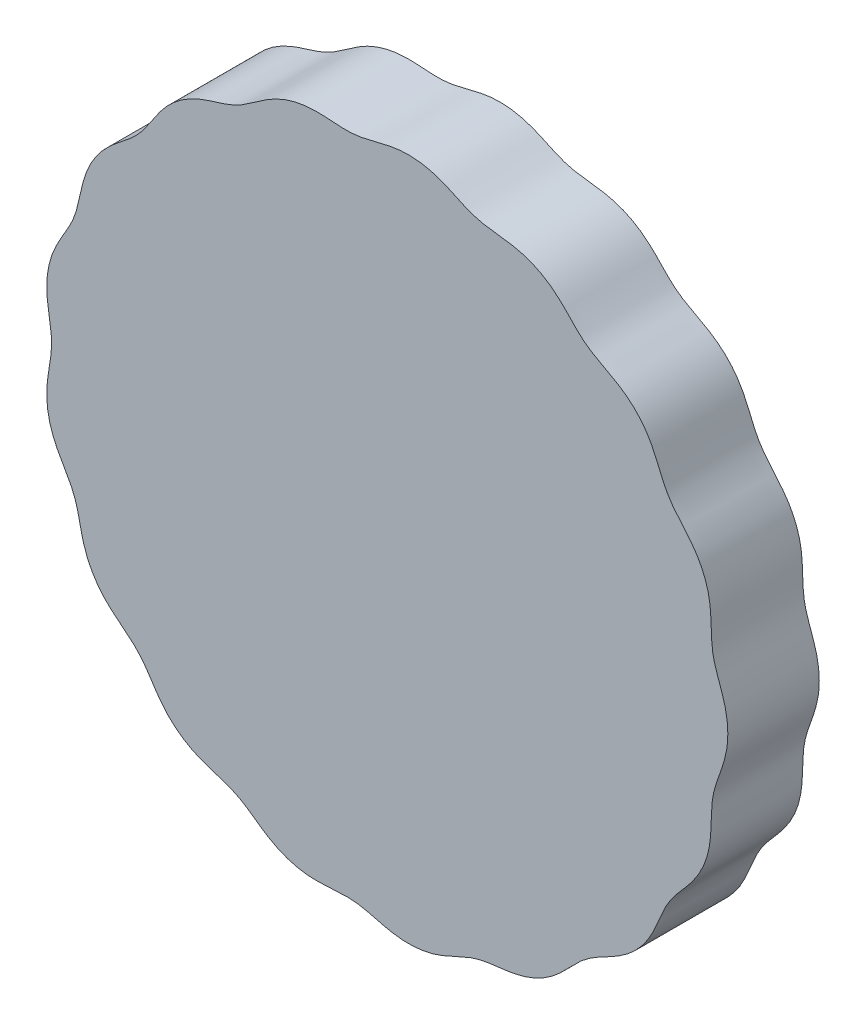
from build123d import *

# Parameters (mm, degrees)
BOSS_EXTRUDE1_DEPTH = 10


with BuildPart() as part:
    # Sketch2 → Boss-Extrude1 (new body)
    with BuildSketch(Plane.XY):
        with BuildLine():
            add(Edge.make_bspline(
                [(37.48, 0), (37.48, 0.075178242), (37.478322449, 0.22585947), (37.470705668, 0.452548867), (37.457778664, 0.680799205), (37.439240456, 0.911160311), (37.414772112, 1.143949805), (37.384089529, 1.379235209), (37.347008687, 1.616849603), (37.303476625, 1.856429261), (37.253598465, 2.097465255), (37.197642965, 2.339358747), (37.136020536, 2.581468839), (37.06927968, 2.823160752), (36.998076094, 3.063838358), (36.92314377, 3.302968371), (36.845282371, 3.540101233), (36.765323933, 3.774880375), (36.684111603, 4.007045523), (36.602490941, 4.236438618), (36.521282596, 4.462997257), (36.441274, 4.686753022), (36.363205353, 4.907824542), (36.28775931, 5.126409313), (36.215551358, 5.342775941), (36.147124421, 5.557253762), (36.082939498, 5.770222896), (36.023371399, 5.982103227), (35.968707527, 6.19334468), (35.919137395, 6.404414384), (35.874759384, 6.615787195), (35.835574051, 6.82793474), (35.801487369, 7.041314777), (35.772312327, 7.256362426), (35.747769521, 7.473478796), (35.727498797, 7.693022062), (35.711056157, 7.915298031), (35.697928433, 8.140551439), (35.687537583, 8.368957377), (35.679251369, 8.600612866), (35.672387324, 8.835529989), (35.66623616, 9.073630301), (35.66006021, 9.314739735), (35.653112028, 9.558585877), (35.644651555, 9.804796808), (35.633953524, 10.052902322), (35.620331131, 10.30233938), (35.603146701, 10.552460303), (35.581833793, 10.802546429), (35.555914545, 11.051827359), (35.525014044, 11.299508464), (35.488871798, 11.544804455), (35.447356629, 11.78698201), (35.400457685, 12.02540694), (35.348279119, 12.259597053), (35.291013733, 12.489270484), (35.228898686, 12.714382206), (35.162167805, 12.935142194), (35.090993895, 13.152004094), (35.01542917, 13.365617568), (34.935376671, 13.576754714), (34.850581775, 13.786214826), (34.760650329, 13.994724041), (34.665117474, 14.202857249), (34.563512478, 14.410981267), (34.455438306, 14.619235648), (34.340633842, 14.82754505), (34.219022112, 15.035659828), (34.090719386, 15.243203199), (33.956045778, 15.449732771), (33.815489892, 15.65478302), (33.669696693, 15.857915354), (33.519423033, 16.05874732), (33.365502857, 16.256970324), (33.208827585, 16.45237613), (33.050301587, 16.644847995), (32.890826318, 16.834370263), (32.731281668, 17.02102633), (32.572498367, 17.204983691), (32.415256579, 17.386497869), (32.260267267, 17.565895068), (32.108160873, 17.743561026), (31.959490238, 17.919937481), (31.814714523, 18.095501119), (31.674205492, 18.270760978), (31.538238747, 18.446239038), (31.406997708, 18.622464624), (31.280565039, 18.799953804), (31.15893923, 18.979210964), (31.042021361, 19.160706627), (30.929626045, 19.344872972), (30.821488519, 19.532096192), (30.717261188, 19.722700801), (30.616526948, 19.91694825), (30.518813274, 20.115030905), (30.423583002, 20.317057649), (30.330266006, 20.523057917), (30.238250813, 20.732967723), (30.146913256, 20.946633861), (30.055612243, 21.163804317), (29.963712362, 21.384131089), (29.870596225, 21.607170252), (29.775670238, 21.832380245), (29.678383537, 22.059130216), (29.57824677, 22.286708464), (29.474830679, 22.51432785), (29.367791555, 22.741145869), (29.256879822, 22.966283883), (29.141943818, 23.188850286), (29.022941092, 23.407975167), (28.899930846, 23.622845416), (28.773069162, 23.832749725), (28.642588668, 24.037123227), (28.508765381, 24.235589845), (28.371876034, 24.427996512), (28.23214737, 24.614431482), (28.089697834, 24.795213927), (27.944493701, 24.970857865), (27.796316611, 25.14200554), (27.644768057, 25.309343941), (27.489294013, 25.473507811), (27.329262793, 25.635011197), (27.164033854, 25.794183575), (26.993060069, 25.951165035), (26.81595148, 26.105910072), (26.632534111, 26.258235655), (26.442865382, 26.407867107), (26.247232129, 26.55449681), (26.046121262, 26.6978274), (25.840186716, 26.837617303), (25.630204925, 26.9737051), (25.417030711, 27.106024257), (25.201558612, 27.234608536), (24.984693579, 27.35960253), (24.767314825, 27.48123886), (24.550261514, 27.599848348), (24.334310167, 27.715834334), (24.12016192, 27.829667441), (23.908437645, 27.941876952), (23.699662064, 28.053024173), (23.494271806, 28.163709249), (23.292602625, 28.274539245), (23.094894993, 28.386127204), (22.901294179, 28.499077673), (22.711852922, 28.613974105), (22.526535054, 28.731367969), (22.345217613, 28.851764021), (22.167702942, 28.975621266), (21.99371614, 29.1033311), (21.822917519, 29.235216917), (21.65490991, 29.371527621), (21.489244435, 29.512427003), (21.32543501, 29.657996299), (21.162958206, 29.808218504), (21.001281895, 29.962995569), (20.839853542, 30.1221227), (20.678133867, 30.285308945), (20.515598553, 30.452168452), (20.351743292, 30.622214792), (20.186114769, 30.794884064), (20.018302446, 30.969519294), (19.847963546, 31.145392193), (19.674826235, 31.32170404), (19.498702947, 31.497603208), (19.319498683, 31.672198396), (19.137212054, 31.844575517), (18.951946773, 32.013828336), (18.763900024, 32.179078193), (18.573360197, 32.339511201), (18.380688849, 32.494412281), (18.186294272, 32.643200536), (17.990595376, 32.785464555), (17.793977611, 32.92099259), (17.596731366, 33.04977484), (17.399009086, 33.172011909), (17.200769228, 33.288070309), (17.001755566, 33.398431983), (16.801496227, 33.503618281), (16.599344717, 33.604113664), (16.394542446, 33.700286982), (16.1863175, 33.792358061), (15.973976109, 33.880376962), (15.756990189, 33.964249767), (15.535057808, 34.043785433), (15.308124571, 34.118740179), (15.076387482, 34.188888837), (14.840259851, 34.254058694), (14.600330729, 34.314165362), (14.357316574, 34.369245403), (14.112008153, 34.419443088), (13.865230834, 34.465029701), (13.617802274, 34.506377946), (13.370506519, 34.543964584), (13.124067272, 34.578337987), (12.879133733, 34.610117476), (12.636267598, 34.63997095), (12.395936191, 34.668594025), (12.158508735, 34.696701452), (11.924256566, 34.725015494), (11.693350585, 34.754240848), (11.465869266, 34.78506532), (11.241799243, 34.818141976), (11.02104344, 34.854073791), (10.803427432, 34.893416859), (10.588706187, 34.936657528), (10.376573289, 34.984215145), (10.166668061, 35.036422943), (9.958586963, 35.09353811), (9.75189071, 35.155720754), (9.546115339, 35.223044448), (9.340780586, 35.29547953), (9.135404579, 35.372912728), (8.929507087, 35.455121316), (8.72263052, 35.541804111), (8.514340976, 35.632557325), (8.304248285, 35.72689934), (8.092010401, 35.824262608), (7.877348413, 35.924008598), (7.660051257, 36.025424387), (7.439992914, 36.127749804), (7.217129978, 36.230168104), (6.991515531, 36.331834803), (6.763299933, 36.431884862), (6.532733192, 36.529452855), (6.300162253, 36.623693722), (6.066025367, 36.713807776), (5.830836002, 36.799060172), (5.595166236, 36.878818042), (5.359612703, 36.952566516), (5.124761113, 37.019939772), (4.891136457, 37.080736126), (4.659149338, 37.134923285), (4.429041421, 37.182627326), (4.200841768, 37.224109405), (3.974336027, 37.259705685), (3.749069812, 37.289770467), (3.52438319, 37.314607451), (3.299479947, 37.334411252), (3.073519557, 37.349222128), (2.8457201, 37.35894429), (2.615448418, 37.36335784), (2.382287491, 37.362172382), (2.146069359, 37.355108801), (1.906874291, 37.341935091), (1.665002975, 37.322530937), (1.420930863, 37.296908991), (1.175253657, 37.26523878), (0.928636876, 37.227825344), (0.681764221, 37.185123923), (0.435302402, 37.137697715), (0.189868895, 37.086206907), (-0.053991616, 37.031390213), (-0.295818193, 36.974028671), (-0.535247081, 36.914937016), (-0.772011608, 36.854939334), (-1.005946804, 36.794854766), (-1.236982681, 36.735479165), (-1.465142879, 36.677570647), (-1.690537113, 36.621844226), (-1.913354776, 36.568958203), (-2.133854298, 36.519501165), (-2.35235627, 36.473992976), (-2.56923111, 36.432868846), (-2.784890031, 36.396481873), (-2.999773794, 36.365091817), (-3.214342925, 36.338867424), (-3.429066444, 36.317884077), (-3.644411469, 36.302116009), (-3.860833427, 36.291443009), (-4.078765878, 36.285655968), (-4.298609982, 36.284451338), (-4.520725674, 36.287438796), (-4.745420723, 36.29415558), (-4.972942624, 36.304058185), (-5.203468233, 36.316545404), (-5.437097392, 36.330953239), (-5.673843427, 36.346579415), (-5.913629039, 36.362680187), (-6.156280498, 36.378494768), (-6.401525317, 36.393246009), (-6.648991244, 36.406166907), (-6.898208788, 36.416512868), (-7.148616915, 36.423573629), (-7.399573535, 36.426696749), (-7.650370765, 36.425311508), (-7.900259331, 36.418938595), (-8.14847732, 36.407208915), (-8.394290178, 36.389889067), (-8.637036148, 36.366865326), (-8.87617912, 36.338166158), (-9.111359177, 36.30392677), (-9.342438496, 36.26436516), (-9.569528805, 36.219733445), (-9.792995498, 36.170262351), (-10.013425677, 36.116099578), (-10.23156669, 36.057263992), (-10.44823604, 35.993618895), (-10.664220991, 35.92488019), (-10.880186452, 35.850654311), (-11.09660681, 35.770508426), (-11.313726684, 35.684036058), (-11.531558528, 35.59092948), (-11.749913042, 35.491037352), (-11.968441586, 35.384387607), (-12.186691982, 35.271198101), (-12.404163053, 35.151868852), (-12.620350054, 35.026956448), (-12.834784946, 34.897147037), (-13.047065135, 34.763225956), (-13.256868844, 34.626039905), (-13.463970493, 34.48647708), (-13.668242009, 34.3454352), (-13.869653604, 34.203800464), (-14.068273293, 34.06243373), (-14.264255916, 33.922147283), (-14.457837587, 33.783696641), (-14.649327636, 33.647769678), (-14.839096854, 33.514979821), (-15.027566269, 33.385854465), (-15.215197218, 33.260836718), (-15.402480239, 33.140278413), (-15.589918547, 33.024433104), (-15.778024426, 32.913466411), (-15.967300877, 32.807444468), (-16.158234543, 32.706343398), (-16.351282159, 32.610042688), (-16.546865361, 32.518340403), (-16.745355458, 32.430943733), (-16.947070201, 32.347487037), (-17.152261507, 32.267527085), (-17.361114088, 32.190568228), (-17.573729982, 32.116048899), (-17.790131053, 32.043373645), (-18.010247125, 31.971908306), (-18.233915289, 31.900996209), (-18.460877342, 31.82997818), (-18.690774738, 31.758187301), (-18.923153424, 31.684980711), (-19.157463116, 31.609742134), (-19.393064135, 31.531897812), (-19.629234216, 31.450930366), (-19.865184941, 31.36639858), (-20.100073037, 31.27794059), (-20.333030388, 31.18529869), (-20.563184694, 31.088310467), (-20.789705564, 30.986934693), (-21.011837084, 30.881229518), (-21.228950064, 30.771350299), (-21.440585647, 30.657522195), (-21.646498768, 30.54000654), (-21.846681397, 30.419049055), (-22.041373008, 30.294830044), (-22.231030795, 30.167404642), (-22.416283881, 30.036672561), (-22.597840854, 29.902345045), (-22.776407899, 29.76397582), (-22.952594104, 29.620998681), (-23.126845453, 29.472806626), (-23.299410392, 29.318836162), (-23.470337101, 29.158648648), (-23.639499062, 28.991988686), (-23.806645906, 28.818822544), (-23.971453074, 28.639341527), (-24.133580148, 28.453949191), (-24.292708494, 28.263226552), (-24.448584548, 28.067898619), (-24.601034032, 27.868788308), (-24.749982131, 27.666779978), (-24.895453359, 27.462783191), (-25.037576187, 27.257704858), (-25.176571959, 27.052421957), (-25.312747073, 26.847761178), (-25.446486917, 26.644487277), (-25.57824333, 26.443289952), (-25.708514362, 26.244770732), (-25.83784821, 26.049446626), (-25.966808745, 25.857733918), (-26.095988574, 25.669960486), (-26.22597238, 25.486352211), (-26.357342319, 25.307043398), (-26.490659454, 25.132076431), (-26.626449734, 24.961400879), (-26.765201524, 24.794885345), (-26.90734689, 24.632314536), (-27.053260735, 24.473402717), (-27.203247102, 24.317794255), (-27.357534231, 24.165073698), (-27.516271375, 24.014775924), (-27.679520016, 23.866392995), (-27.847252886, 23.719386211), (-28.019348929, 23.573196137), (-28.195596806, 23.427259198), (-28.375682416, 23.281007642), (-28.559203473, 23.133896382), (-28.745662591, 22.985405891), (-28.934469792, 22.835053417), (-29.124955637, 22.682414191), (-29.31637003, 22.527122869), (-29.507897914, 22.368888296), (-29.698674766, 22.207509146), (-29.887796174, 22.042870199), (-30.07434982, 21.874961722), (-30.257432782, 21.703869888), (-30.436186912, 21.529778425), (-30.609837742, 21.352961616), (-30.777725399, 21.173756115), (-30.93935143, 20.992539683), (-31.094402718, 20.809682202), (-31.242785499, 20.625504069), (-31.384616051, 20.440211464), (-31.520219057, 20.253857769), (-31.650062559, 20.066291666), (-31.774701201, 19.877152442), (-31.894691311, 19.685888147), (-32.010508884, 19.491805763), (-32.122487149, 19.294153412), (-32.230795615, 19.092218351), (-32.335433207, 18.885413882), (-32.436264207, 18.673351582), (-32.533070191, 18.455884013), (-32.625603894, 18.233113853), (-32.71363789, 18.005374122), (-32.797015737, 17.773196464), (-32.875667725, 17.537260117), (-32.949640003, 17.298347978), (-33.019084885, 17.057295855), (-33.084274413, 16.814956795), (-33.145575877, 16.572164421), (-33.20345086, 16.329708206), (-33.258434392, 16.088312996), (-33.311122116, 15.848624499), (-33.362157668, 15.611201133), (-33.412211979, 15.376504917), (-33.461971326, 15.144899466), (-33.512131545, 14.916651763), (-33.563369172, 14.691929019), (-33.616347381, 14.470807219), (-33.67168638, 14.253269508), (-33.729972892, 14.039218031), (-33.791728971, 13.828473794), (-33.857419322, 13.620789454), (-33.927438297, 13.415855713), (-34.00209503, 13.213306362), (-34.081622909, 13.012732609), (-34.166157731, 12.813686066), (-34.255749784, 12.615694415), (-34.350349384, 12.418266547), (-34.449815946, 12.220907192), (-34.553913678, 12.0231265), (-34.662310696, 11.824449482), (-34.774586211, 11.624430744), (-34.890235297, 11.422666009), (-35.008664619, 11.218798594), (-35.129214055, 11.012537324), (-35.251147184, 10.803658888), (-35.373673516, 10.592021542), (-35.495959898, 10.377574346), (-35.617134073, 10.160355972), (-35.736314316, 9.940507594), (-35.852621984, 9.718268319), (-35.965204596, 9.493972646), (-36.073265738, 9.268042443), (-36.176089048, 9.040970872), (-36.2730708, 8.813298171), (-36.363745836, 8.58557718), (-36.44781335, 8.358330429), (-36.525151031, 8.131998184), (-36.595812963, 7.906884094), (-36.660013296, 7.683103115), (-36.718086542, 7.460545144), (-36.770420525, 7.238857504), (-36.817397438, 7.017468789), (-36.859316247, 6.795637718), (-36.896343689, 6.572538941), (-36.928495128, 6.347360302), (-36.9556456, 6.119402507), (-36.977568583, 5.888156386), (-36.993997324, 5.653353931), (-37.004676875, 5.414980629), (-37.009434121, 5.173261626), (-37.008197779, 4.928621662), (-37.001038672, 4.681635897), (-36.988163487, 4.432975584), (-36.969916966, 4.183359196), (-36.946769912, 3.933508249), (-36.919294813, 3.684113395), (-36.888154821, 3.435806157), (-36.854072144, 3.189141922), (-36.817812925, 2.944587035), (-36.780173235, 2.702511003), (-36.741949827, 2.463184501), (-36.703934085, 2.226778683), (-36.666897124, 1.993367108), (-36.631568498, 1.762933137), (-36.598639187, 1.535372464), (-36.568737342, 1.310503499), (-36.542430196, 1.088073938), (-36.520207513, 0.867771442), (-36.502484036, 0.649232056), (-36.489587134, 0.432050865), (-36.481751935, 0.215792247), (-36.479125251, 0), (-36.481751935, -0.215792247), (-36.489587134, -0.432050865), (-36.502484036, -0.649232056), (-36.520207513, -0.867771442), (-36.542430196, -1.088073938), (-36.568737342, -1.310503499), (-36.598639187, -1.535372464), (-36.631568498, -1.762933137), (-36.666897124, -1.993367108), (-36.703934085, -2.226778683), (-36.741949827, -2.463184501), (-36.780173235, -2.702511003), (-36.817812925, -2.944587035), (-36.854072144, -3.189141922), (-36.888154821, -3.435806157), (-36.919294813, -3.684113395), (-36.946769912, -3.933508249), (-36.969916966, -4.183359196), (-36.988163487, -4.432975584), (-37.001038672, -4.681635897), (-37.008197779, -4.928621662), (-37.009434121, -5.173261626), (-37.004676875, -5.414980629), (-36.993997324, -5.653353931), (-36.977568583, -5.888156386), (-36.9556456, -6.119402507), (-36.928495128, -6.347360302), (-36.896343689, -6.572538941), (-36.859316247, -6.795637718), (-36.817397438, -7.017468789), (-36.770420525, -7.238857504), (-36.718086542, -7.460545144), (-36.660013296, -7.683103115), (-36.595812963, -7.906884094), (-36.525151031, -8.131998184), (-36.44781335, -8.358330429), (-36.363745836, -8.58557718), (-36.2730708, -8.813298171), (-36.176089048, -9.040970872), (-36.073265738, -9.268042443), (-35.965204596, -9.493972646), (-35.852621984, -9.718268319), (-35.736314316, -9.940507594), (-35.617134073, -10.160355972), (-35.495959898, -10.377574346), (-35.373673516, -10.592021542), (-35.251147184, -10.803658888), (-35.129214055, -11.012537324), (-35.008664619, -11.218798594), (-34.890235297, -11.422666009), (-34.774586211, -11.624430744), (-34.662310696, -11.824449482), (-34.553913678, -12.0231265), (-34.449815946, -12.220907192), (-34.350349384, -12.418266547), (-34.255749784, -12.615694415), (-34.166157731, -12.813686066), (-34.081622909, -13.012732609), (-34.00209503, -13.213306362), (-33.927438297, -13.415855713), (-33.857419322, -13.620789454), (-33.791728971, -13.828473794), (-33.729972892, -14.039218031), (-33.67168638, -14.253269508), (-33.616347381, -14.470807219), (-33.563369172, -14.691929019), (-33.512131545, -14.916651763), (-33.461971326, -15.144899466), (-33.412211979, -15.376504917), (-33.362157668, -15.611201133), (-33.311122116, -15.848624499), (-33.258434392, -16.088312996), (-33.20345086, -16.329708206), (-33.145575877, -16.572164421), (-33.084274413, -16.814956795), (-33.019084885, -17.057295855), (-32.949640003, -17.298347978), (-32.875667725, -17.537260117), (-32.797015737, -17.773196464), (-32.71363789, -18.005374122), (-32.625603894, -18.233113853), (-32.533070191, -18.455884013), (-32.436264207, -18.673351582), (-32.335433207, -18.885413882), (-32.230795615, -19.092218351), (-32.122487149, -19.294153412), (-32.010508884, -19.491805763), (-31.894691311, -19.685888147), (-31.774701201, -19.877152442), (-31.650062559, -20.066291666), (-31.520219057, -20.253857769), (-31.384616051, -20.440211464), (-31.242785499, -20.625504069), (-31.094402718, -20.809682202), (-30.93935143, -20.992539683), (-30.777725399, -21.173756115), (-30.609837742, -21.352961616), (-30.436186912, -21.529778425), (-30.257432782, -21.703869888), (-30.07434982, -21.874961722), (-29.887796174, -22.042870199), (-29.698674766, -22.207509146), (-29.507897914, -22.368888296), (-29.31637003, -22.527122869), (-29.124955637, -22.682414191), (-28.934469792, -22.835053417), (-28.745662591, -22.985405891), (-28.559203473, -23.133896382), (-28.375682416, -23.281007642), (-28.195596806, -23.427259198), (-28.019348929, -23.573196137), (-27.847252886, -23.719386211), (-27.679520016, -23.866392995), (-27.516271375, -24.014775924), (-27.357534231, -24.165073698), (-27.203247102, -24.317794255), (-27.053260735, -24.473402717), (-26.90734689, -24.632314536), (-26.765201524, -24.794885345), (-26.626449734, -24.961400879), (-26.490659454, -25.132076431), (-26.357342319, -25.307043398), (-26.22597238, -25.486352211), (-26.095988574, -25.669960486), (-25.966808745, -25.857733918), (-25.83784821, -26.049446626), (-25.708514362, -26.244770732), (-25.57824333, -26.443289952), (-25.446486917, -26.644487277), (-25.312747073, -26.847761178), (-25.176571959, -27.052421957), (-25.037576187, -27.257704858), (-24.895453359, -27.462783191), (-24.749982131, -27.666779978), (-24.601034032, -27.868788308), (-24.448584548, -28.067898619), (-24.292708494, -28.263226552), (-24.133580148, -28.453949191), (-23.971453074, -28.639341527), (-23.806645906, -28.818822544), (-23.639499062, -28.991988686), (-23.470337101, -29.158648648), (-23.299410392, -29.318836162), (-23.126845453, -29.472806626), (-22.952594104, -29.620998681), (-22.776407899, -29.76397582), (-22.597840854, -29.902345045), (-22.416283881, -30.036672561), (-22.231030795, -30.167404642), (-22.041373008, -30.294830044), (-21.846681397, -30.419049055), (-21.646498768, -30.54000654), (-21.440585647, -30.657522195), (-21.228950064, -30.771350299), (-21.011837084, -30.881229518), (-20.789705564, -30.986934693), (-20.563184694, -31.088310467), (-20.333030388, -31.18529869), (-20.100073037, -31.27794059), (-19.865184941, -31.36639858), (-19.629234216, -31.450930366), (-19.393064135, -31.531897812), (-19.157463116, -31.609742134), (-18.923153424, -31.684980711), (-18.690774738, -31.758187301), (-18.460877342, -31.82997818), (-18.233915289, -31.900996209), (-18.010247125, -31.971908306), (-17.790131053, -32.043373645), (-17.573729982, -32.116048899), (-17.361114088, -32.190568228), (-17.152261507, -32.267527085), (-16.947070201, -32.347487037), (-16.745355458, -32.430943733), (-16.546865361, -32.518340403), (-16.351282159, -32.610042688), (-16.158234543, -32.706343398), (-15.967300877, -32.807444468), (-15.778024426, -32.913466411), (-15.589918547, -33.024433104), (-15.402480239, -33.140278413), (-15.215197218, -33.260836718), (-15.027566269, -33.385854465), (-14.839096854, -33.514979821), (-14.649327636, -33.647769678), (-14.457837587, -33.783696641), (-14.264255916, -33.922147283), (-14.068273293, -34.06243373), (-13.869653604, -34.203800464), (-13.668242009, -34.3454352), (-13.463970493, -34.48647708), (-13.256868844, -34.626039905), (-13.047065135, -34.763225956), (-12.834784946, -34.897147037), (-12.620350054, -35.026956448), (-12.404163053, -35.151868852), (-12.186691982, -35.271198101), (-11.968441586, -35.384387607), (-11.749913042, -35.491037352), (-11.531558528, -35.59092948), (-11.313726684, -35.684036058), (-11.09660681, -35.770508426), (-10.880186452, -35.850654311), (-10.664220991, -35.92488019), (-10.44823604, -35.993618895), (-10.23156669, -36.057263992), (-10.013425677, -36.116099578), (-9.792995498, -36.170262351), (-9.569528805, -36.219733445), (-9.342438496, -36.26436516), (-9.111359177, -36.30392677), (-8.87617912, -36.338166158), (-8.637036148, -36.366865326), (-8.394290178, -36.389889067), (-8.14847732, -36.407208915), (-7.900259331, -36.418938595), (-7.650370765, -36.425311508), (-7.399573535, -36.426696749), (-7.148616915, -36.423573629), (-6.898208788, -36.416512868), (-6.648991244, -36.406166907), (-6.401525317, -36.393246009), (-6.156280498, -36.378494768), (-5.913629039, -36.362680187), (-5.673843427, -36.346579415), (-5.437097392, -36.330953239), (-5.203468233, -36.316545404), (-4.972942624, -36.304058185), (-4.745420723, -36.29415558), (-4.520725674, -36.287438796), (-4.298609982, -36.284451338), (-4.078765878, -36.285655968), (-3.860833427, -36.291443009), (-3.644411469, -36.302116009), (-3.429066444, -36.317884077), (-3.214342925, -36.338867424), (-2.999773794, -36.365091817), (-2.784890031, -36.396481873), (-2.56923111, -36.432868846), (-2.35235627, -36.473992976), (-2.133854298, -36.519501165), (-1.913354776, -36.568958203), (-1.690537113, -36.621844226), (-1.465142879, -36.677570647), (-1.236982681, -36.735479165), (-1.005946804, -36.794854766), (-0.772011608, -36.854939334), (-0.535247081, -36.914937016), (-0.295818193, -36.974028671), (-0.053991616, -37.031390213), (0.189868895, -37.086206907), (0.435302402, -37.137697715), (0.681764221, -37.185123923), (0.928636876, -37.227825344), (1.175253657, -37.26523878), (1.420930863, -37.296908991), (1.665002975, -37.322530937), (1.906874291, -37.341935091), (2.146069359, -37.355108801), (2.382287491, -37.362172382), (2.615448418, -37.36335784), (2.8457201, -37.35894429), (3.073519557, -37.349222128), (3.299479947, -37.334411252), (3.52438319, -37.314607451), (3.749069812, -37.289770467), (3.974336027, -37.259705685), (4.200841768, -37.224109405), (4.429041421, -37.182627326), (4.659149338, -37.134923285), (4.891136457, -37.080736126), (5.124761113, -37.019939772), (5.359612703, -36.952566516), (5.595166236, -36.878818042), (5.830836002, -36.799060172), (6.066025367, -36.713807776), (6.300162253, -36.623693722), (6.532733192, -36.529452855), (6.763299933, -36.431884862), (6.991515531, -36.331834803), (7.217129978, -36.230168104), (7.439992914, -36.127749804), (7.660051257, -36.025424387), (7.877348413, -35.924008598), (8.092010401, -35.824262608), (8.304248285, -35.72689934), (8.514340976, -35.632557325), (8.72263052, -35.541804111), (8.929507087, -35.455121316), (9.135404579, -35.372912728), (9.340780586, -35.29547953), (9.546115339, -35.223044448), (9.75189071, -35.155720754), (9.958586963, -35.09353811), (10.166668061, -35.036422943), (10.376573289, -34.984215145), (10.588706187, -34.936657528), (10.803427432, -34.893416859), (11.02104344, -34.854073791), (11.241799243, -34.818141976), (11.465869266, -34.78506532), (11.693350585, -34.754240848), (11.924256566, -34.725015494), (12.158508735, -34.696701452), (12.395936191, -34.668594025), (12.636267598, -34.63997095), (12.879133733, -34.610117476), (13.124067272, -34.578337987), (13.370506519, -34.543964584), (13.617802274, -34.506377946), (13.865230834, -34.465029701), (14.112008153, -34.419443088), (14.357316574, -34.369245403), (14.600330729, -34.314165362), (14.840259851, -34.254058694), (15.076387482, -34.188888837), (15.308124571, -34.118740179), (15.535057808, -34.043785433), (15.756990189, -33.964249767), (15.973976109, -33.880376962), (16.1863175, -33.792358061), (16.394542446, -33.700286982), (16.599344717, -33.604113664), (16.801496227, -33.503618281), (17.001755566, -33.398431983), (17.200769228, -33.288070309), (17.399009086, -33.172011909), (17.596731366, -33.04977484), (17.793977611, -32.92099259), (17.990595376, -32.785464555), (18.186294272, -32.643200536), (18.380688849, -32.494412281), (18.573360197, -32.339511201), (18.763900024, -32.179078193), (18.951946773, -32.013828336), (19.137212054, -31.844575517), (19.319498683, -31.672198396), (19.498702947, -31.497603208), (19.674826235, -31.32170404), (19.847963546, -31.145392193), (20.018302446, -30.969519294), (20.186114769, -30.794884064), (20.351743292, -30.622214792), (20.515598553, -30.452168452), (20.678133867, -30.285308945), (20.839853542, -30.1221227), (21.001281895, -29.962995569), (21.162958206, -29.808218504), (21.32543501, -29.657996299), (21.489244435, -29.512427003), (21.65490991, -29.371527621), (21.822917519, -29.235216917), (21.99371614, -29.1033311), (22.167702942, -28.975621266), (22.345217613, -28.851764021), (22.526535054, -28.731367969), (22.711852922, -28.613974105), (22.901294179, -28.499077673), (23.094894993, -28.386127204), (23.292602625, -28.274539245), (23.494271806, -28.163709249), (23.699662064, -28.053024173), (23.908437645, -27.941876952), (24.12016192, -27.829667441), (24.334310167, -27.715834334), (24.550261514, -27.599848348), (24.767314825, -27.48123886), (24.984693579, -27.35960253), (25.201558612, -27.234608536), (25.417030711, -27.106024257), (25.630204925, -26.9737051), (25.840186716, -26.837617303), (26.046121262, -26.6978274), (26.247232129, -26.55449681), (26.442865382, -26.407867107), (26.632534111, -26.258235655), (26.81595148, -26.105910072), (26.993060069, -25.951165035), (27.164033854, -25.794183575), (27.329262793, -25.635011197), (27.489294013, -25.473507811), (27.644768057, -25.309343941), (27.796316611, -25.14200554), (27.944493701, -24.970857865), (28.089697834, -24.795213927), (28.23214737, -24.614431482), (28.371876034, -24.427996512), (28.508765381, -24.235589845), (28.642588668, -24.037123227), (28.773069162, -23.832749725), (28.899930846, -23.622845416), (29.022941092, -23.407975167), (29.141943818, -23.188850286), (29.256879822, -22.966283883), (29.367791555, -22.741145869), (29.474830679, -22.51432785), (29.57824677, -22.286708464), (29.678383537, -22.059130216), (29.775670238, -21.832380245), (29.870596225, -21.607170252), (29.963712362, -21.384131089), (30.055612243, -21.163804317), (30.146913256, -20.946633861), (30.238250813, -20.732967723), (30.330266006, -20.523057917), (30.423583002, -20.317057649), (30.518813274, -20.115030905), (30.616526948, -19.91694825), (30.717261188, -19.722700801), (30.821488519, -19.532096192), (30.929626045, -19.344872972), (31.042021361, -19.160706627), (31.15893923, -18.979210964), (31.280565039, -18.799953804), (31.406997708, -18.622464624), (31.538238747, -18.446239038), (31.674205492, -18.270760978), (31.814714523, -18.095501119), (31.959490238, -17.919937481), (32.108160873, -17.743561026), (32.260267267, -17.565895068), (32.415256579, -17.386497869), (32.572498367, -17.204983691), (32.731281668, -17.02102633), (32.890826318, -16.834370263), (33.050301587, -16.644847995), (33.208827585, -16.45237613), (33.365502857, -16.256970324), (33.519423033, -16.05874732), (33.669696693, -15.857915354), (33.815489892, -15.65478302), (33.956045778, -15.449732771), (34.090719386, -15.243203199), (34.219022112, -15.035659828), (34.340633842, -14.82754505), (34.455438306, -14.619235648), (34.563512478, -14.410981267), (34.665117474, -14.202857249), (34.760650329, -13.994724041), (34.850581775, -13.786214826), (34.935376671, -13.576754714), (35.01542917, -13.365617568), (35.090993895, -13.152004094), (35.162167805, -12.935142194), (35.228898686, -12.714382206), (35.291013733, -12.489270484), (35.348279119, -12.259597053), (35.400457685, -12.02540694), (35.447356629, -11.78698201), (35.488871798, -11.544804455), (35.525014044, -11.299508464), (35.555914545, -11.051827359), (35.581833793, -10.802546429), (35.603146701, -10.552460303), (35.620331131, -10.30233938), (35.633953524, -10.052902322), (35.644651555, -9.804796808), (35.653112028, -9.558585877), (35.66006021, -9.314739735), (35.66623616, -9.073630301), (35.672387324, -8.835529989), (35.679251369, -8.600612866), (35.687537583, -8.368957377), (35.697928433, -8.140551439), (35.711056157, -7.915298031), (35.727498797, -7.693022062), (35.747769521, -7.473478796), (35.772312327, -7.256362426), (35.801487369, -7.041314777), (35.835574051, -6.82793474), (35.874759384, -6.615787195), (35.919137395, -6.404414384), (35.968707527, -6.19334468), (36.023371399, -5.982103227), (36.082939498, -5.770222896), (36.147124421, -5.557253762), (36.215551358, -5.342775941), (36.28775931, -5.126409313), (36.363205353, -4.907824542), (36.441274, -4.686753022), (36.521282596, -4.462997257), (36.602490941, -4.236438618), (36.684111603, -4.007045523), (36.765323933, -3.774880375), (36.845282371, -3.540101233), (36.92314377, -3.302968371), (36.998076094, -3.063838358), (37.06927968, -2.823160752), (37.136020536, -2.581468839), (37.197642965, -2.339358747), (37.253598465, -2.097465255), (37.303476625, -1.856429261), (37.347008687, -1.616849603), (37.384089529, -1.379235209), (37.414772112, -1.143949805), (37.439240456, -0.911160311), (37.457778664, -0.680799205), (37.470705668, -0.452548867), (37.478322449, -0.22585947), (37.48, -0.075178242), (37.48, 0)],
                knots=[0, 0, 0, 0, 0.000957102, 0.001918338, 0.002887447, 0.003867432, 0.004860345, 0.005867197, 0.006887982, 0.007921793, 0.008967001, 0.010021416, 0.01108248, 0.012147431, 0.01321345, 0.01427776, 0.015337734, 0.016390971, 0.017435362, 0.018469111, 0.019490813, 0.020499461, 0.021494463, 0.022475681, 0.023443411, 0.02439839, 0.025341775, 0.026275118, 0.027200311, 0.028119535, 0.029035187, 0.02994978, 0.030865878, 0.031785986, 0.032712467, 0.033647456, 0.034592784, 0.03554994, 0.036520009, 0.03750365, 0.038501085, 0.03951209, 0.040536002, 0.041571743, 0.042617834, 0.043672426, 0.044733346, 0.045798154, 0.04686419, 0.047928661, 0.048988746, 0.050041711, 0.051085055, 0.05211667, 0.053135036, 0.054139402, 0.055129931, 0.056107817, 0.057075294, 0.058035513, 0.058992307, 0.059949846, 0.060912216, 0.061883052, 0.062865199, 0.063860529, 0.064869869, 0.065893041, 0.066928999, 0.067976005, 0.069031783, 0.070093741, 0.071159085, 0.072225, 0.073288728, 0.074347682, 0.075399504, 0.076442134, 0.077473853, 0.078493311, 0.079499581, 0.080492151, 0.081470951, 0.082436366, 0.083389201, 0.084330692, 0.085262449, 0.086186427, 0.087104842, 0.088020116, 0.088934791, 0.089851418, 0.090772488, 0.091700321, 0.092637008, 0.093584328, 0.094543696, 0.095516126, 0.096502198, 0.097502054, 0.098515397, 0.099541489, 0.100579176, 0.101626908, 0.102682785, 0.103744577, 0.104809796, 0.10587576, 0.106939662, 0.107998686, 0.109050127, 0.110091538, 0.111120907, 0.112136834, 0.113138715, 0.114126895, 0.115102756, 0.116068703, 0.117028021, 0.117984641, 0.118942742, 0.119906363, 0.120879013, 0.121863381, 0.122861153, 0.123872969, 0.124898497, 0.125936551, 0.12698528, 0.128042346, 0.129105105, 0.130170755, 0.131236482, 0.132299549, 0.13335741, 0.134407748, 0.13544857, 0.136478207, 0.137495395, 0.138499271, 0.139489403, 0.140465804, 0.141428926, 0.142379658, 0.143319305, 0.144249539, 0.145172365, 0.146090047, 0.14700503, 0.147919865, 0.148837098, 0.149759198, 0.150688452, 0.151626896, 0.152576249, 0.153537857, 0.154512667, 0.155501173, 0.156503444, 0.157519104, 0.158547336, 0.159586915, 0.160636236, 0.161693323, 0.16275591, 0.163821463, 0.164887269, 0.165950512, 0.167008389, 0.168058227, 0.169097645, 0.170124723, 0.17113819, 0.172137599, 0.173123477, 0.174097384, 0.1750619, 0.176020444, 0.17697702, 0.177935811, 0.178900792, 0.179875344, 0.180861983, 0.181862217, 0.182876501, 0.183904349, 0.184944437, 0.185994816, 0.187053085, 0.18811656, 0.189182429, 0.190247878, 0.19131021, 0.192366903, 0.193415695, 0.194454652, 0.195482178, 0.196497064, 0.197498536, 0.198486227, 0.19946024, 0.200421099, 0.201369773, 0.202307625, 0.203236398, 0.204158144, 0.205075169, 0.205989937, 0.206905014, 0.207822929, 0.208746133, 0.209676868, 0.210617122, 0.211568554, 0.212532436, 0.213509635, 0.214500578, 0.215505252, 0.216523202, 0.217553537, 0.218594963, 0.219645806, 0.22070404, 0.221767338, 0.222833135, 0.223898697, 0.224961193, 0.226017839, 0.227066002, 0.228103366, 0.229128111, 0.230139104, 0.231136059, 0.232119682, 0.233091718, 0.234054909, 0.235012806, 0.235969469, 0.236929076, 0.23789552, 0.238872049, 0.239861009, 0.240863716, 0.241880458, 0.242910581, 0.243952643, 0.2450046, 0.24606399, 0.247128089, 0.248194088, 0.249259182, 0.25032069, 0.251376147, 0.252423335, 0.253460381, 0.254485748, 0.255498317, 0.256497365, 0.257482628, 0.258454268, 0.259412892, 0.260359544, 0.261295659, 0.262223034, 0.263143774, 0.264060217, 0.264974857, 0.265890248, 0.266808926, 0.267733301, 0.26866558, 0.269607696, 0.270561245, 0.271527424, 0.272507031, 0.273500413, 0.274507477, 0.275527687, 0.276560086, 0.277603309, 0.278655609, 0.279714912, 0.280778845, 0.281844801, 0.282910027, 0.283971693, 0.285027026, 0.286073441, 0.28710869, 0.28813107, 0.289139582, 0.2901341, 0.291115523, 0.292085774, 0.293047752, 0.294005127, 0.29496201, 0.295922557, 0.296890565, 0.297869146, 0.298860467, 0.29986566, 0.300884834, 0.301917187, 0.302961157, 0.304014614, 0.30507504, 0.306139679, 0.307205717, 0.308270368, 0.309330984, 0.310385133, 0.311430662, 0.312465745, 0.313488924, 0.314499144, 0.315495767, 0.316478603, 0.317447886, 0.318404314, 0.319348991, 0.320283421, 0.321209467, 0.322129272, 0.323045213, 0.323959798, 0.32487559, 0.325795102, 0.326720717, 0.327654599, 0.328598629, 0.329554329, 0.330522834, 0.331504862, 0.332500674, 0.333510109, 0.334532552, 0.335566971, 0.336611934, 0.33766563, 0.33872593, 0.339790414, 0.340856448, 0.341921248, 0.342981997, 0.344035936, 0.345080529, 0.346113613, 0.347133595, 0.348139617, 0.349131734, 0.350111011, 0.351079567, 0.352040451, 0.352997433, 0.353954668, 0.354916268, 0.355885944, 0.356866643, 0.357860358, 0.35886804, 0.359889623, 0.36092416, 0.361969971, 0.363024851, 0.364086219, 0.365151314, 0.366217304, 0.367281432, 0.368341075, 0.369393849, 0.370437657, 0.371470734, 0.372491691, 0.373499547, 0.374493738, 0.375474152, 0.376441104, 0.377395367, 0.378338116, 0.379270923, 0.380195703, 0.38111465, 0.382030165, 0.382944779, 0.383861045, 0.384781465, 0.385708389, 0.386643937, 0.387589924, 0.388547816, 0.389518668, 0.39050312, 0.391501361, 0.392513146, 0.393537792, 0.394574186, 0.39562083, 0.396675854, 0.397737077, 0.39880203, 0.39986805, 0.400932345, 0.401992086, 0.403044552, 0.404087258, 0.405118127, 0.406135685, 0.40713922, 0.408128962, 0.409106168, 0.410073123, 0.411033027, 0.411989752, 0.412947459, 0.413910236, 0.414881667, 0.415864548, 0.416860689, 0.417870854, 0.418894816, 0.419931478, 0.420979065, 0.422035286, 0.423097516, 0.424162975, 0.425228837, 0.426292356, 0.427350949, 0.428402286, 0.429444318, 0.430475347, 0.431494051, 0.432499522, 0.433491281, 0.43446928, 0.43543393, 0.436386061, 0.437326928, 0.438258171, 0.439181757, 0.440099919, 0.441015088, 0.441929808, 0.44284663, 0.443768032, 0.444696335, 0.4456336, 0.446581592, 0.447541705, 0.448514924, 0.449501807, 0.450502473, 0.451516588, 0.452543401, 0.453581722, 0.454629988, 0.455686276, 0.456748343, 0.457813682, 0.458879604, 0.459943296, 0.461001949, 0.462052865, 0.463093616, 0.464122225, 0.465137332, 0.466138391, 0.467125798, 0.468101001, 0.469066455, 0.470025506, 0.470982094, 0.471940412, 0.472904471, 0.473877747, 0.474862866, 0.475861458, 0.4768741, 0.477900407, 0.478939146, 0.479988431, 0.481045906, 0.482108915, 0.483174647, 0.484240291, 0.485303121, 0.486360599, 0.487410433, 0.488450637, 0.489479574, 0.490495999, 0.491499073, 0.492488393, 0.493463994, 0.494426358, 0.495376401, 0.496315444, 0.497245183, 0.498167642, 0.499085095, 0.5, 0.500914905, 0.501832358, 0.502754817, 0.503684556, 0.504623599, 0.505573642, 0.506536006, 0.507511607, 0.508500927, 0.509504001, 0.510520426, 0.511549363, 0.512589567, 0.513639401, 0.514696879, 0.515759709, 0.516825353, 0.517891085, 0.518954094, 0.520011569, 0.521060854, 0.522099593, 0.5231259, 0.524138542, 0.525137134, 0.526122253, 0.527095529, 0.528059588, 0.529017906, 0.529974494, 0.530933545, 0.531898999, 0.532874202, 0.533861609, 0.534862668, 0.535877775, 0.536906384, 0.537947135, 0.538998051, 0.540056704, 0.541120396, 0.542186318, 0.543251657, 0.544313724, 0.545370012, 0.546418278, 0.547456599, 0.548483412, 0.549497527, 0.550498193, 0.551485076, 0.552458295, 0.553418408, 0.5543664, 0.555303665, 0.556231968, 0.55715337, 0.558070192, 0.558984912, 0.559900081, 0.560818243, 0.561741829, 0.562673072, 0.563613939, 0.56456607, 0.56553072, 0.566508719, 0.567500478, 0.568505949, 0.569524653, 0.570555682, 0.571597714, 0.572649051, 0.573707644, 0.574771163, 0.575837025, 0.576902484, 0.577964714, 0.579020935, 0.580068522, 0.581105184, 0.582129146, 0.583139311, 0.584135452, 0.585118333, 0.586089764, 0.587052541, 0.588010248, 0.588966973, 0.589926877, 0.590893832, 0.591871038, 0.59286078, 0.593864315, 0.594881873, 0.595912742, 0.596955448, 0.598007914, 0.599067655, 0.60013195, 0.60119797, 0.602262923, 0.603324146, 0.60437917, 0.605425814, 0.606462208, 0.607486854, 0.608498639, 0.60949688, 0.610481332, 0.611452184, 0.612410076, 0.613356063, 0.614291611, 0.615218535, 0.616138955, 0.617055221, 0.617969835, 0.61888535, 0.619804297, 0.620729077, 0.621661884, 0.622604633, 0.623558896, 0.624525848, 0.625506262, 0.626500453, 0.627508309, 0.628529266, 0.629562343, 0.630606151, 0.631658925, 0.632718568, 0.633782696, 0.634848686, 0.635913781, 0.636975149, 0.638030029, 0.63907584, 0.640110377, 0.64113196, 0.642139642, 0.643133357, 0.644114056, 0.645083732, 0.646045332, 0.647002567, 0.647959549, 0.648920433, 0.649888989, 0.650868266, 0.651860383, 0.652866405, 0.653886387, 0.654919471, 0.655964064, 0.657018003, 0.658078752, 0.659143552, 0.660209586, 0.66127407, 0.66233437, 0.663388066, 0.664433029, 0.665467448, 0.666489891, 0.667499326, 0.668495138, 0.669477166, 0.670445671, 0.671401371, 0.672345401, 0.673279283, 0.674204898, 0.67512441, 0.676040202, 0.676954787, 0.677870728, 0.678790533, 0.679716579, 0.680651009, 0.681595686, 0.682552114, 0.683521397, 0.684504233, 0.685500856, 0.686511076, 0.687534255, 0.688569338, 0.689614867, 0.690669016, 0.691729632, 0.692794283, 0.693860321, 0.69492496, 0.695985386, 0.697038843, 0.698082813, 0.699115166, 0.70013434, 0.701139533, 0.702130854, 0.703109435, 0.704077443, 0.70503799, 0.705994873, 0.706952248, 0.707914226, 0.708884477, 0.7098659, 0.710860418, 0.71186893, 0.71289131, 0.713926559, 0.714972974, 0.716028307, 0.717089973, 0.718155199, 0.719221155, 0.720285088, 0.721344391, 0.722396691, 0.723439914, 0.724472313, 0.725492523, 0.726499587, 0.727492969, 0.728472576, 0.729438755, 0.730392304, 0.73133442, 0.732266699, 0.733191074, 0.734109752, 0.735025143, 0.735939783, 0.736856226, 0.737776966, 0.738704341, 0.739640456, 0.740587108, 0.741545732, 0.742517372, 0.743502635, 0.744501683, 0.745514252, 0.746539619, 0.747576665, 0.748623853, 0.74967931, 0.750740818, 0.751805912, 0.752871911, 0.75393601, 0.7549954, 0.756047357, 0.757089419, 0.758119542, 0.759136284, 0.760138991, 0.761127951, 0.76210448, 0.763070924, 0.764030531, 0.764987194, 0.765945091, 0.766908282, 0.767880318, 0.768863941, 0.769860896, 0.770871889, 0.771896634, 0.772933998, 0.773982161, 0.775038807, 0.776101303, 0.777166865, 0.778232662, 0.77929596, 0.780354194, 0.781405037, 0.782446463, 0.783476798, 0.784494748, 0.785499422, 0.786490365, 0.787467564, 0.788431446, 0.789382878, 0.790323132, 0.791253867, 0.792177071, 0.793094986, 0.794010063, 0.794924831, 0.795841856, 0.796763602, 0.797692375, 0.798630227, 0.799578901, 0.80053976, 0.801513773, 0.802501464, 0.803502936, 0.804517822, 0.805545348, 0.806584305, 0.807633097, 0.80868979, 0.809752122, 0.810817571, 0.81188344, 0.812946915, 0.814005184, 0.815055563, 0.816095651, 0.817123499, 0.818137783, 0.819138017, 0.820124656, 0.821099208, 0.822064189, 0.82302298, 0.823979556, 0.8249381, 0.825902616, 0.826876523, 0.827862401, 0.82886181, 0.829875277, 0.830902355, 0.831941773, 0.832991611, 0.834049488, 0.835112731, 0.836178537, 0.83724409, 0.838306677, 0.839363764, 0.840413085, 0.841452664, 0.842480896, 0.843496556, 0.844498827, 0.845487333, 0.846462143, 0.847423751, 0.848373104, 0.849311548, 0.850240802, 0.851162902, 0.852080135, 0.85299497, 0.853909953, 0.854827635, 0.855750461, 0.856680695, 0.857620342, 0.858571074, 0.859534196, 0.860510597, 0.861500729, 0.862504605, 0.863521793, 0.86455143, 0.865592252, 0.86664259, 0.867700451, 0.868763518, 0.869829245, 0.870894895, 0.871957654, 0.87301472, 0.874063449, 0.875101503, 0.876127031, 0.877138847, 0.878136619, 0.879120987, 0.880093637, 0.881057258, 0.882015359, 0.882971979, 0.883931297, 0.884897244, 0.885873105, 0.886861285, 0.887863166, 0.888879093, 0.889908462, 0.890949873, 0.892001314, 0.893060338, 0.89412424, 0.895190204, 0.896255423, 0.897317215, 0.898373092, 0.899420824, 0.900458511, 0.901484603, 0.902497946, 0.903497802, 0.904483874, 0.905456304, 0.906415672, 0.907362992, 0.908299679, 0.909227512, 0.910148582, 0.911065209, 0.911979884, 0.912895158, 0.913813573, 0.914737551, 0.915669308, 0.916610799, 0.917563634, 0.918529049, 0.919507849, 0.920500419, 0.921506689, 0.922526147, 0.923557866, 0.924600496, 0.925652318, 0.926711272, 0.927775, 0.928840915, 0.929906259, 0.930968217, 0.932023995, 0.933071001, 0.934106959, 0.935130131, 0.936139471, 0.937134801, 0.938116948, 0.939087784, 0.940050154, 0.941007693, 0.941964487, 0.942924706, 0.943892183, 0.944870069, 0.945860598, 0.946864964, 0.94788333, 0.948914945, 0.949958289, 0.951011254, 0.952071339, 0.95313581, 0.954201846, 0.955266654, 0.956327574, 0.957382166, 0.958428257, 0.959463998, 0.96048791, 0.961498915, 0.96249635, 0.963479991, 0.96445006, 0.965407216, 0.966352544, 0.967287533, 0.968214014, 0.969134122, 0.97005022, 0.970964813, 0.971880465, 0.972799689, 0.973724882, 0.974658225, 0.97560161, 0.976556589, 0.977524319, 0.978505537, 0.979500539, 0.980509187, 0.981530889, 0.982564638, 0.983609029, 0.984662266, 0.98572224, 0.98678655, 0.987852569, 0.98891752, 0.989978584, 0.991032999, 0.992078207, 0.993112018, 0.994132803, 0.995139655, 0.996132568, 0.997112553, 0.998081662, 0.999042898, 1, 1, 1, 1], degree=3))
        make_face()
    extrude(amount=BOSS_EXTRUDE1_DEPTH)


solid = part.part
